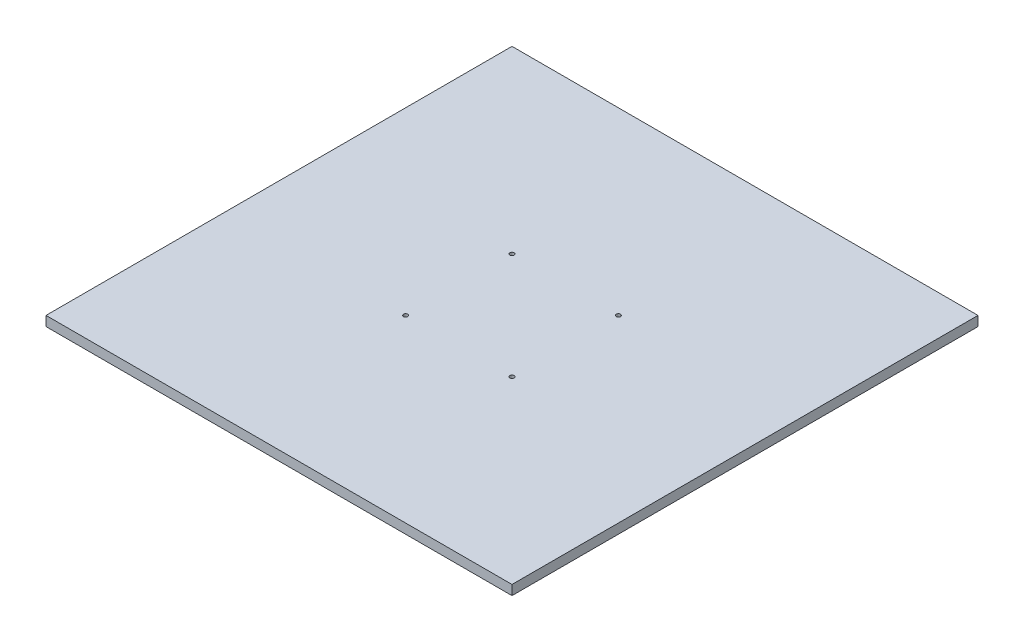
from build123d import *

# Parameters (mm, degrees)
SKETCH1_W           = 609.6
SKETCH1_H           = 609.6
SKETCH1_R           = 2.794
BOSS_EXTRUDE1_DEPTH = 12.7


with BuildPart() as part:
    # Sketch1 → Boss-Extrude1 (new body)
    with BuildSketch(Plane(origin=(0, 0, 0), x_dir=(1, 0, 0), z_dir=(0, 1, 0))):
        Rectangle(SKETCH1_W, SKETCH1_H)
        with Locations(Location((-69.596984938, -69.596984938, 0), (0, 0, 270))):
            Circle(SKETCH1_R, mode=Mode.SUBTRACT)
        with Locations(Location((69.596984938, -69.596984938, 0), (0, 0, 270))):
            Circle(SKETCH1_R, mode=Mode.SUBTRACT)
        with Locations(Location((-69.596984938, 69.596984938, 0), (0, 0, 270))):
            Circle(SKETCH1_R, mode=Mode.SUBTRACT)
        with Locations(Location((69.596984938, 69.596984938, 0), (0, 0, 270))):
            Circle(SKETCH1_R, mode=Mode.SUBTRACT)
    extrude(amount=BOSS_EXTRUDE1_DEPTH)


solid = part.part
